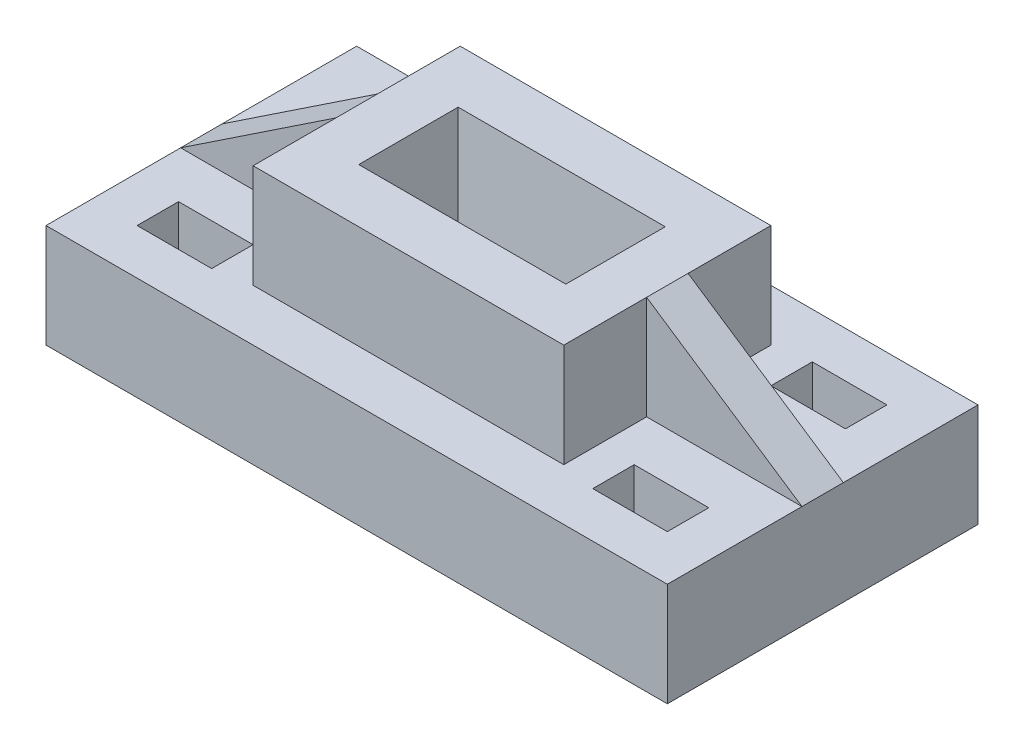
from build123d import *

# Parameters (mm, degrees)
SKETCH2_W               = 150
SKETCH2_H               = 75
BOSS_EXTRUDE1_DEPTH     = 12.5
SKETCH3_W               = 75
SKETCH3_H               = 50
BOSS_EXTRUDE3_DEPTH     = 25
SKETCH4_W               = 50
SKETCH4_H               = 24
CUT_EXTRUDE1_DEPTH      = 25
CUT_EXTRUDE1_DRAFT      = -5
SKETCH5_W               = 18
SKETCH5_H               = 10
CUT_EXTRUDE2_DEPTH      = 88.5
MIRROR2_COPY_1_SKETCH_W = 18
MIRROR2_COPY_1_SKETCH_H = 10
MIRROR2_COPY_1_DEPTH    = 88.5
RIB1_REACH              = 93.856
SKETCH6_WALL_W          = 230.781121652
SKETCH6_WALL_H          = 10


with BuildPart() as part:
    # Sketch2 → Boss-Extrude1 (new, symmetric)
    with BuildSketch(Plane(origin=(0, 0, 0), x_dir=(1, 0, 0), z_dir=(0, 1, 0))):
        Rectangle(SKETCH2_W, SKETCH2_H)
    extrude(amount=BOSS_EXTRUDE1_DEPTH, both=True)

    # Sketch3 → Boss-Extrude3 (add)
    with BuildSketch(Plane(origin=(0, 12.5, 0), x_dir=(1, 0, 0), z_dir=(0, 1, 0))):
        Rectangle(SKETCH3_W, SKETCH3_H)
    extrude(amount=BOSS_EXTRUDE3_DEPTH)


with BuildPart() as cut_extrude1_tool:
    # Sketch4 → Cut-Extrude1 (with draft: the straight prism first)
    with BuildSketch(Plane(origin=(0, 37.5, 0), x_dir=(1, 0, 0), z_dir=(0, 1, 0))):
        Rectangle(SKETCH4_W, SKETCH4_H)
    extrude(amount=-CUT_EXTRUDE1_DEPTH)
    # Cut-Extrude1: the draft: its side faces are tilted about the plane it starts from
    cut_extrude1_sides = [cut_extrude1_tool.faces().sort_by_distance(p)[0] for p in [
        (-25, 25, 0),
        (0, 25, 12),
        (25, 25, 0),
        (0, 25, -12),
    ]]
    draft(cut_extrude1_sides, Plane(origin=(0, 37.5, 0), x_dir=(1, 0, 0), z_dir=(0, 1, 0)), CUT_EXTRUDE1_DRAFT)


with BuildPart() as part_1:
    add(part.part)

    # Cut-Extrude1: cut by cut_extrude1_tool
    add(cut_extrude1_tool.part, mode=Mode.SUBTRACT)

    # Sketch5 → Cut-Extrude2 (cut, through all)
    with BuildSketch(Plane(origin=(0, 12.5, 0), x_dir=(1, 0, 0), z_dir=(0, 1, 0))):
        with Locations((55, -21.5)):
            Rectangle(SKETCH5_W, SKETCH5_H)
    cut_extrude2 = extrude(amount=-CUT_EXTRUDE2_DEPTH, mode=Mode.SUBTRACT)

    # Mirror1: Cut-Extrude2 across plane
    add(cut_extrude2.mirror(Plane(origin=(0, 0, 0), x_dir=(0, 0, 1), z_dir=(1, 0, 0))), mode=Mode.SUBTRACT)

    # Mirror2: Cut-Extrude2 across plane
    add(cut_extrude2.mirror(Plane.XY), mode=Mode.SUBTRACT)

    # Mirror2 copy 1 sketch → Mirror2 copy 1 (cut, through all)
    with BuildSketch(Plane(origin=(0, 12.5, 0), x_dir=(-1, 0, 0), z_dir=(0, 1, 0))):
        with Locations((55, -21.5)):
            Rectangle(MIRROR2_COPY_1_SKETCH_W, MIRROR2_COPY_1_SKETCH_H)
    extrude(amount=-MIRROR2_COPY_1_DEPTH, mode=Mode.SUBTRACT)

    # Sketch6 wall → Rib1 (add, up to next)
    with BuildSketch(Plane(origin=(-56.25, 25, 0), x_dir=(0.832050294338, 0.554700196225, 0), z_dir=(-0.554700196225, 0.832050294338, 0)), mode=Mode.PRIVATE) as rib1_sk1:
        Rectangle(SKETCH6_WALL_W, SKETCH6_WALL_H)
    rib1_tool1 = extrude(rib1_sk1.sketch, amount=-RIB1_REACH, mode=Mode.PRIVATE) - part_1.part
    rib1 = rib1_tool1.solids().sort_by_distance((-56.25, 25, 0))[0]
    add(rib1)

    # Mirror3: Rib1 across plane
    add(rib1.mirror(Plane(origin=(0, 0, 0), x_dir=(0, 0, 1), z_dir=(1, 0, 0))))


solid = part_1.part
